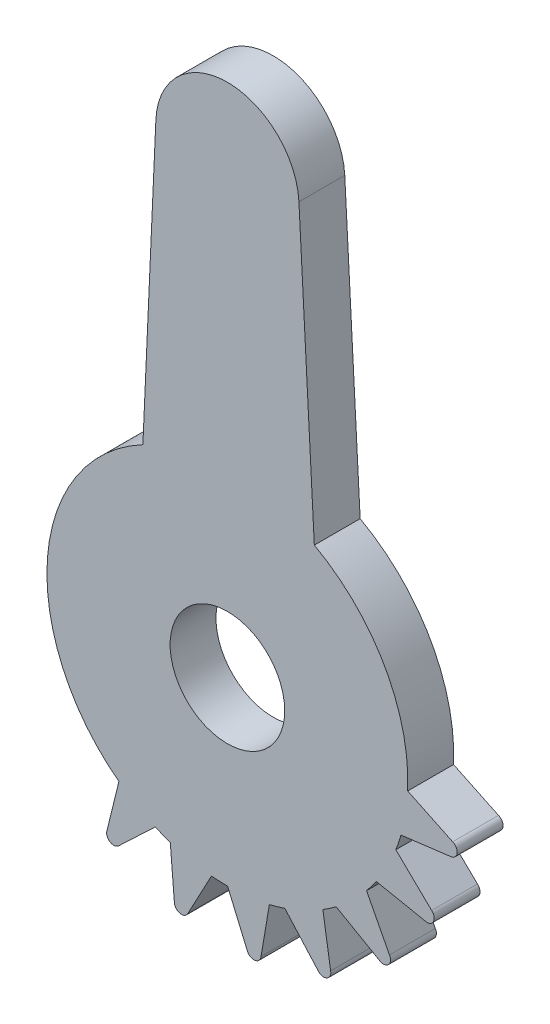
from build123d import *

# Parameters (mm, degrees)
SKETCH4_R           = 4
BOSS_EXTRUDE4_DEPTH = 3.2
BOSS_EXTRUDE6_START = -3.2
BOSS_EXTRUDE6_DEPTH = 3.2
CIRPATTERN3_COUNT   = 7
CIRPATTERN3_ANGLE   = 111


with BuildPart() as part:
    # Sketch4 → Boss-Extrude4 (new body)
    with BuildSketch(Plane.XY):
        with BuildLine():
            Line((21.067900641, 33.325122256), (19.993019925, 53.547837419))
            ThreePointArc((19.993019925, 53.547837419), (14.939517656, 58.282084655), (10.002153079, 53.426838719))
            Line((10.002153079, 53.426838719), (9.098366441, 33.414868889))
            ThreePointArc((9.098366441, 33.414868889), (14.90552884, 9.682805465), (21.067900641, 33.325122256))
        make_face()
        with Locations((15, 22.282451301)):
            Circle(SKETCH4_R, mode=Mode.SUBTRACT)
    extrude(amount=BOSS_EXTRUDE4_DEPTH)

    # Sketch6 → Boss-Extrude6 (add)
    with BuildSketch(Plane.XY.offset(3.2).offset(BOSS_EXTRUDE6_START)):
        with BuildLine():
            Line((27.587419579, 21.71954071), (30.726886196, 20.216575064))
            ThreePointArc((30.726886196, 20.216575064), (31.03657327, 19.658315603), (30.545192773, 19.250755893))
            Line((30.545192773, 19.250755893), (27.114578574, 18.81878475))
            ThreePointArc((27.114578574, 18.81878475), (27.435866455, 20.255328827), (27.587419579, 21.71954071))
        make_face()
    boss_extrude6 = extrude(amount=BOSS_EXTRUDE6_DEPTH)

    # CirPattern3: Boss-Extrude6 ×7 about axis
    cirpattern3_axis = Axis((15, 22.282451301, 0), (0, 0, -1))
    for i in range(1, CIRPATTERN3_COUNT):
        add(boss_extrude6.rotate(cirpattern3_axis, i * CIRPATTERN3_ANGLE / (CIRPATTERN3_COUNT - 1)))


solid = part.part
